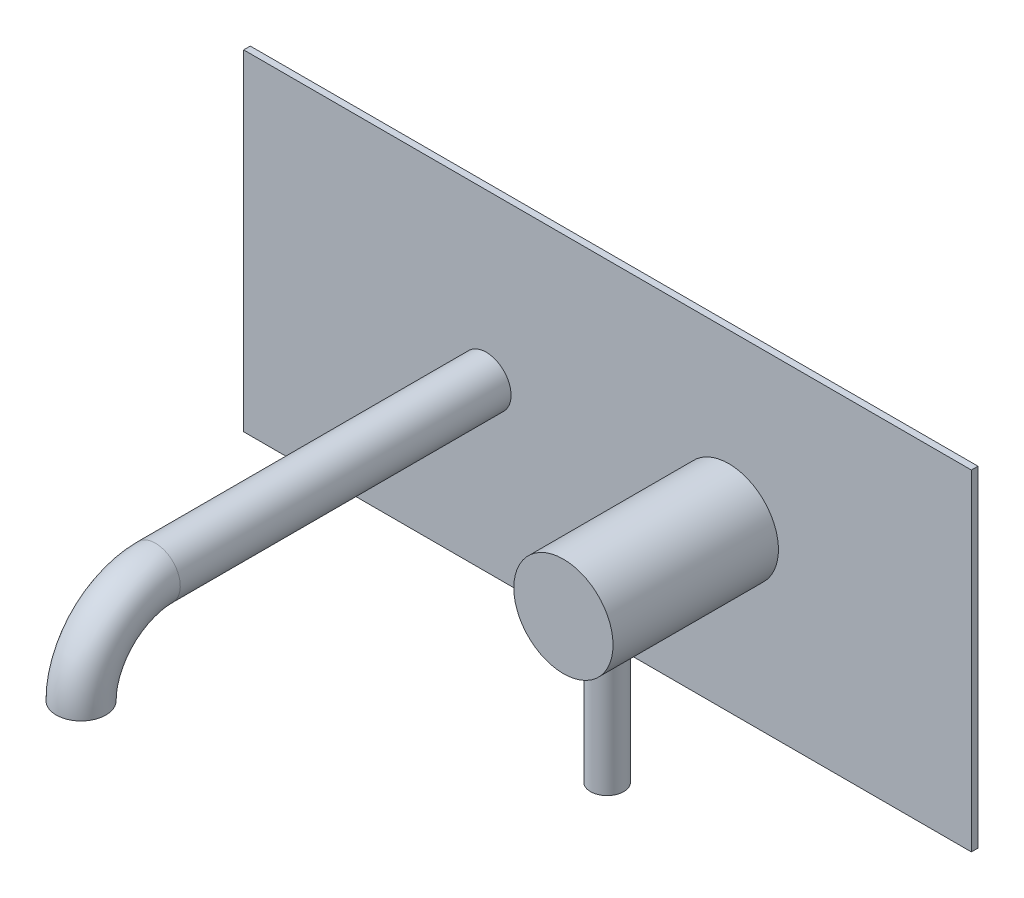
from build123d import *

# Parameters (mm, degrees)
SKETCH_1_W        = 220
SKETCH_1_H        = 100
EXTRUDE_1_DEPTH   = 2
SWEEP_1_PROFILE_R = 7.5
SKETCH_15_R       = 15
EXTRUDE_2_DEPTH   = 50
SKETCH_16_R       = 5
EXTRUDE_3_DEPTH   = 50


with BuildPart() as part:
    # Эскиз1 → Бобышка-Вытянуть1 (new body)
    with BuildSketch(Plane.XY):
        with Locations((110, 50)):
            Rectangle(SKETCH_1_W, SKETCH_1_H)
    extrude(amount=EXTRUDE_1_DEPTH)

    # По траектории1: sweep along a curve in space
    with BuildLine() as sweep_1_path:
        Line((73.333333333, 50, 2), (73.333333333, 50, 102))
        ThreePointArc((73.333333333, 50, 102), (73.333333333, 43.409902577, 117.909902577), (73.333333333, 27.5, 124.5))
    # По траектории1 profile (on start of the path) → По траектории1 (sweep)
    with BuildSketch(Plane(origin=(73.333333333, 50, 2), x_dir=(1, 0, 0), z_dir=(0, 0, 1))):
        Circle(SWEEP_1_PROFILE_R)
    sweep(path=sweep_1_path.line)

    # Эскиз15 → Бобышка-Вытянуть2 (add)
    with BuildSketch(Plane.XY.offset(2)):
        with Locations(Location((146.666666667, 50, 0), (0, 0, 180))):
            Circle(SKETCH_15_R)
    extrude(amount=EXTRUDE_2_DEPTH)

    # Эскиз16 → Бобышка-Вытянуть3 (add)
    with BuildSketch(Plane(origin=(0, 50, 0), x_dir=(-1, 0, 0), z_dir=(0, -1, 0))):
        with Locations(Location((-146.666666667, -38.788976591, 0), (0, 0, 270))):
            Circle(SKETCH_16_R)
    extrude(amount=EXTRUDE_3_DEPTH)


solid = part.part
